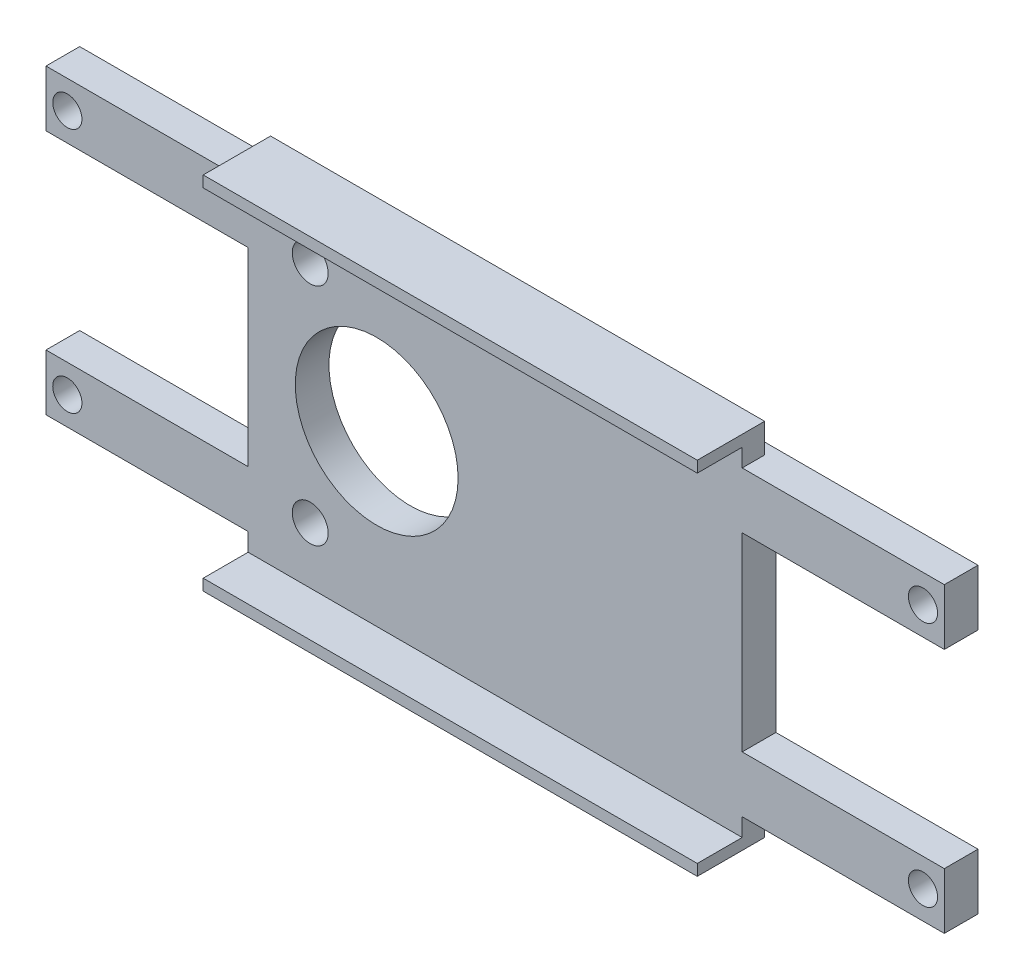
from build123d import *

# Parameters (mm, degrees)
RESSALTO_EXTRUS_O1_DEPTH = 3
ESBO_O2_R                = 1.3
CORTE_EXTRUS_O1_DEPTH    = 3
ESBO_O3_W                = 2
ESBO_O3_H                = 16.9
RESSALTO_EXTRUS_O2_DEPTH = 3
ESBO_O4_R                = 7.25
CORTE_EXTRUS_O2_DEPTH    = 3
ESBO_O6_R                = 1.6
CORTE_EXTRUS_O3_DEPTH    = 3
ESBO_O7_W                = 44
ESBO_O7_H                = 2.6
RESSALTO_EXTRUS_O4_DEPTH = 2
ESBO_O8_W                = 44
ESBO_O8_H                = 1
RESSALTO_EXTRUS_O5_DEPTH = 4


with BuildPart() as part:
    # Esboço1 → Ressalto-extrusão1 (new body)
    with BuildSketch(Plane.XY):
        Polygon((-40, 0), (40, 0), (40, 5), (20, 5), (20, 21.9), (40, 21.9), (40, 26.9), (-40, 26.9), (-40, 21.9), (-20, 21.9), (-20, 5), (-40, 5), align=None)
    extrude(amount=RESSALTO_EXTRUS_O1_DEPTH)

    # Esboço2 → Corte-extrusão1 (cut)
    with BuildSketch(Plane.XY.offset(3)):
        with Locations((-38.1, 24.4)):
            Circle(ESBO_O2_R)
        with Locations((38.1, 24.4)):
            Circle(ESBO_O2_R)
        with Locations(Location((38.1, 2.5, 0), (0, 0, 180))):
            Circle(ESBO_O2_R)
        with Locations(Location((-38.1, 2.5, 0), (0, 0, 180))):
            Circle(ESBO_O2_R)
    extrude(amount=-CORTE_EXTRUS_O1_DEPTH, mode=Mode.SUBTRACT)

    # Esboço3 → Ressalto-extrusão2 (add)
    with BuildSketch(Plane.XY.offset(3)):
        with Locations((-21, 13.45)):
            Rectangle(ESBO_O3_W, ESBO_O3_H)
        with Locations((21, 13.45)):
            Rectangle(ESBO_O3_W, ESBO_O3_H)
    extrude(amount=-RESSALTO_EXTRUS_O2_DEPTH)

    # Esboço4 → Corte-extrusão2 (cut)
    with BuildSketch(Plane.XY.offset(3)):
        with Locations((-10.55, 13.45)):
            Circle(ESBO_O4_R)
    extrude(amount=-CORTE_EXTRUS_O2_DEPTH, mode=Mode.SUBTRACT)

    # Esboço6 → Corte-extrusão3 (cut)
    with BuildSketch(Plane.XY.offset(3)):
        with Locations((-16.47, 23.47)):
            Circle(ESBO_O6_R)
        with Locations(Location((-16.47, 3.43, 0), (0, 0, 180))):
            Circle(ESBO_O6_R)
    extrude(amount=-CORTE_EXTRUS_O3_DEPTH, mode=Mode.SUBTRACT)

    # Esboço7 → Ressalto-extrusão4 (add)
    with BuildSketch(Plane.XY.offset(3)):
        with Locations((0, 28.2)):
            Rectangle(ESBO_O7_W, ESBO_O7_H)
        with Locations((0, -1.3)):
            Rectangle(ESBO_O7_W, ESBO_O7_H)
    extrude(amount=-RESSALTO_EXTRUS_O4_DEPTH)

    # Esboço8 → Ressalto-extrusão5 (add)
    with BuildSketch(Plane.XY.offset(3)):
        with Locations((0, 29)):
            Rectangle(ESBO_O8_W, ESBO_O8_H)
        with Locations((0, -2.1)):
            Rectangle(ESBO_O8_W, ESBO_O8_H)
    extrude(amount=RESSALTO_EXTRUS_O5_DEPTH)


solid = part.part
